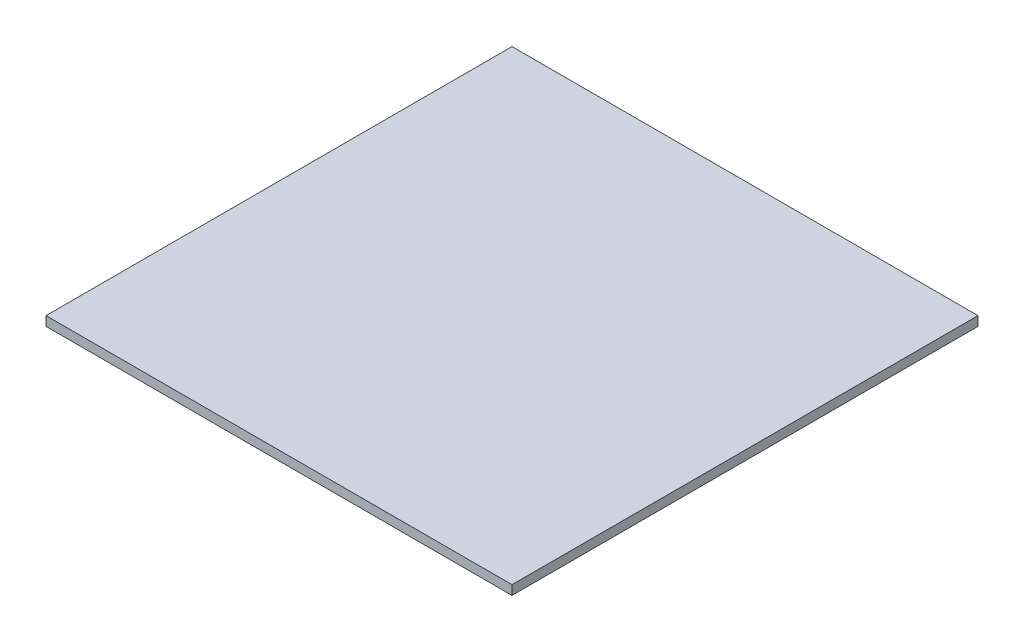
from build123d import *

# Parameters (mm, degrees)
SZKIC1_W                    = 500
SZKIC1_H                    = 500
DODANIE_WYCI_GNI_CIE1_DEPTH = 10


with BuildPart() as part:
    # Szkic1 → Dodanie-wyciągnięcie1 (new body)
    with BuildSketch(Plane(origin=(0, 0, 0), x_dir=(1, 0, 0), z_dir=(0, 1, 0))):
        with Locations((250, 250)):
            Rectangle(SZKIC1_W, SZKIC1_H)
    extrude(amount=DODANIE_WYCI_GNI_CIE1_DEPTH)


solid = part.part
